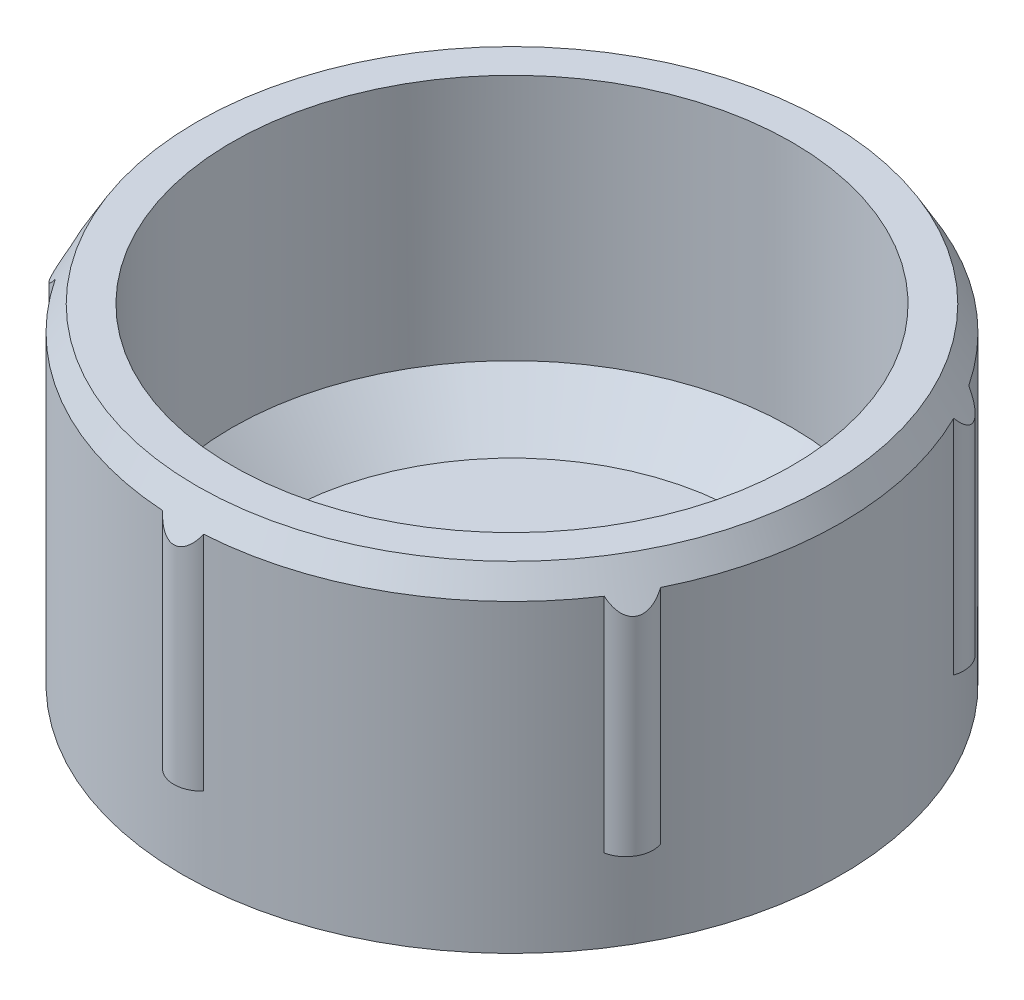
from build123d import *

# Parameters (mm, degrees)
BOSS_EXTRUDE1_DEPTH = 15
CUT_EXTRUDE1_REACH  = 35.839
SKETCH5_R           = 1.7
CHAMFER1_SIZE       = 3


with BuildPart() as part:
    # Sketch2 → Revolve1 (revolve)
    with BuildSketch(Plane.XY, mode=Mode.PRIVATE) as revolve1_sk:
        Polygon((0, 0), (-20, 0), (-20, 20), (-17, 20), (-17, 2), (0, 2), align=None)
    revolve(revolve1_sk.sketch.rotate(Axis((0, 0, 0), (0, 1, 0)), 270), axis=Axis((0, 0, 0), (0, 1, 0)))

    # Sketch3 → Boss-Extrude1 (add)
    with BuildSketch(Plane(origin=(0, 20, 0), x_dir=(1, 0, 0), z_dir=(0, 1, 0))):
        with BuildLine():
            ThreePointArc((-1.25, 19.960899278), (0, 20.52), (1.25, 19.960899278))
            ThreePointArc((1.25, 19.960899278), (0, 20), (-1.25, 19.960899278))
        make_face()
        with BuildLine():
            ThreePointArc((16.661645857, 11.062981394), (17.320508076, 10), (17.911645857, 8.897917884))
            ThreePointArc((17.911645857, 8.897917884), (17.770841286, 10.26), (16.661645857, 11.062981394))
        make_face()
        with BuildLine():
            ThreePointArc((17.911645857, -8.897917884), (17.320508076, -10), (16.661645857, -11.062981394))
            ThreePointArc((16.661645857, -11.062981394), (17.770841286, -10.26), (17.911645857, -8.897917884))
        make_face()
        with BuildLine():
            ThreePointArc((1.25, -19.960899278), (0, -20), (-1.25, -19.960899278))
            ThreePointArc((-1.25, -19.960899278), (0, -20.52), (1.25, -19.960899278))
        make_face()
        with BuildLine():
            ThreePointArc((-16.661645857, -11.062981394), (-17.320508076, -10), (-17.911645857, -8.897917884))
            ThreePointArc((-17.911645857, -8.897917884), (-17.770841286, -10.26), (-16.661645857, -11.062981394))
        make_face()
        with BuildLine():
            ThreePointArc((-17.911645857, 8.897917884), (-17.320508076, 10), (-16.661645857, 11.062981394))
            ThreePointArc((-16.661645857, 11.062981394), (-17.770841286, 10.26), (-17.911645857, 8.897917884))
        make_face()
    extrude(amount=-BOSS_EXTRUDE1_DEPTH)

    # Sketch4 → Cut-Revolve1 (revolve, cut)
    with BuildSketch(Plane.XY, mode=Mode.PRIVATE) as cut_revolve1_sk:
        Polygon((-21, 16.767949192), (-18.556624327, 21), (-21, 21), align=None)
    revolve(cut_revolve1_sk.sketch.rotate(Axis((0, 20, 0), (0, -1, 0)), 90), axis=Axis((0, 20, 0), (0, -1, 0)), mode=Mode.SUBTRACT)

    # Sketch5 → Cut-Extrude1 (cut, up to next)
    with BuildSketch(Plane(origin=(0, 2, 0), x_dir=(1, 0, 0), z_dir=(0, 1, 0)), mode=Mode.PRIVATE) as cut_extrude1_sk1:
        with Locations(Location((0, 9.5, 0), (0, 0, 270))):
            Circle(SKETCH5_R)
    cut_extrude1_tool1 = extrude(cut_extrude1_sk1.sketch, amount=-CUT_EXTRUDE1_REACH, mode=Mode.PRIVATE) & part.part
    # Sketch5 → Cut-Extrude1 (cut, up to next)
    with BuildSketch(Plane(origin=(0, 2, 0), x_dir=(1, 0, 0), z_dir=(0, 1, 0)), mode=Mode.PRIVATE) as cut_extrude1_sk2:
        with Locations(Location((8.227241336, -4.75, 0), (0, 0, 270))):
            Circle(SKETCH5_R)
    cut_extrude1_tool2 = extrude(cut_extrude1_sk2.sketch, amount=-CUT_EXTRUDE1_REACH, mode=Mode.PRIVATE) & part.part
    # Sketch5 → Cut-Extrude1 (cut, up to next)
    with BuildSketch(Plane(origin=(0, 2, 0), x_dir=(1, 0, 0), z_dir=(0, 1, 0)), mode=Mode.PRIVATE) as cut_extrude1_sk3:
        with Locations(Location((-8.227241336, -4.75, 0), (0, 0, 270))):
            Circle(SKETCH5_R)
    cut_extrude1_tool3 = extrude(cut_extrude1_sk3.sketch, amount=-CUT_EXTRUDE1_REACH, mode=Mode.PRIVATE) & part.part
    add(cut_extrude1_tool1.solids().sort_by_distance((0, 2, -9.5))[0], mode=Mode.SUBTRACT)
    add(cut_extrude1_tool2.solids().sort_by_distance((8.227241, 2, 4.75))[0], mode=Mode.SUBTRACT)
    add(cut_extrude1_tool3.solids().sort_by_distance((-8.227241, 2, 4.75))[0], mode=Mode.SUBTRACT)

    # Chamfer1
    chamfer1_edges = [part.edges().sort_by_distance(p)[0] for p in [
        (0, 2, 17),
    ]]
    chamfer(chamfer1_edges, length=CHAMFER1_SIZE)


solid = part.part
